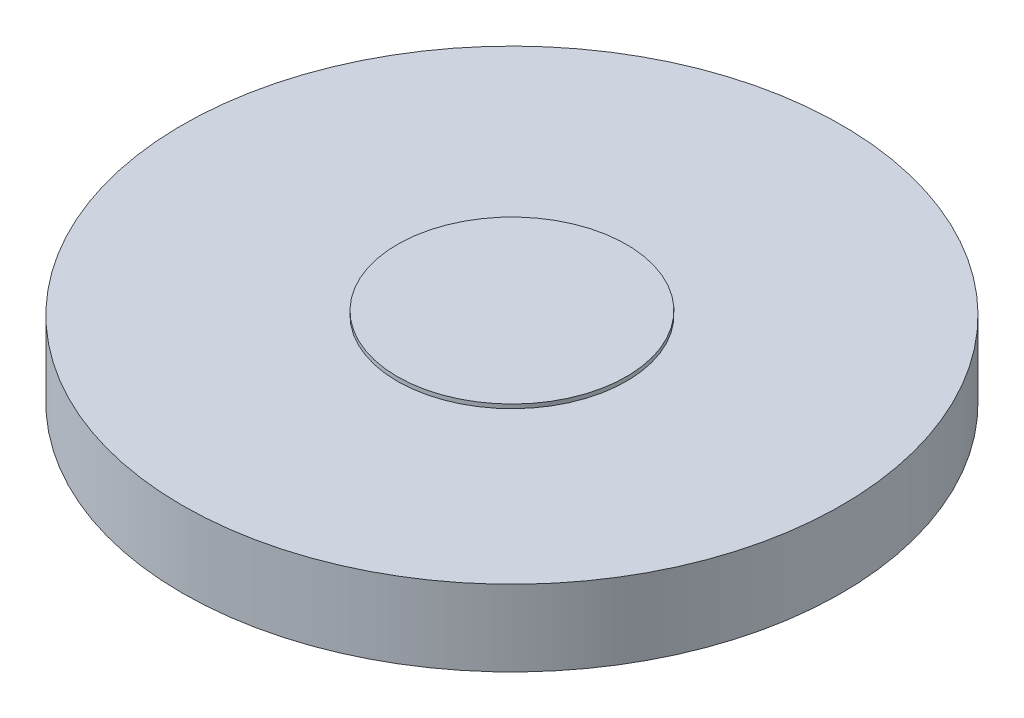
from build123d import *

# Parameters (mm, degrees)
SKETCH1_R           = 10.414
BOSS_EXTRUDE1_DEPTH = 2.4003
SKETCH2_R           = 4.2418
BOSS_EXTRUDE2_DEPTH = 5.842
SKETCH3_R           = 3.6195
BOSS_EXTRUDE3_DEPTH = 0.127


with BuildPart() as part:
    # Sketch1 → Boss-Extrude1 (new body)
    with BuildSketch(Plane(origin=(0, 0, 0), x_dir=(1, 0, 0), z_dir=(0, 1, 0))):
        with Locations(Location((0, 0, 0), (0, 0, 270))):
            Circle(SKETCH1_R)
    extrude(amount=BOSS_EXTRUDE1_DEPTH)

    # Sketch2 → Boss-Extrude2 (add)
    with BuildSketch(Plane(origin=(0, 2.4003, 0), x_dir=(1, 0, 0), z_dir=(0, 1, 0))):
        with Locations(Location((0, 0, 0), (0, 0, 270))):
            Circle(SKETCH2_R)
    extrude(amount=-BOSS_EXTRUDE2_DEPTH)

    # Sketch3 → Boss-Extrude3 (add)
    with BuildSketch(Plane(origin=(0, 2.4003, 0), x_dir=(1, 0, 0), z_dir=(0, 1, 0))):
        with Locations(Location((0, 0, 0), (0, 0, 270))):
            Circle(SKETCH3_R)
    extrude(amount=BOSS_EXTRUDE3_DEPTH)


solid = part.part
